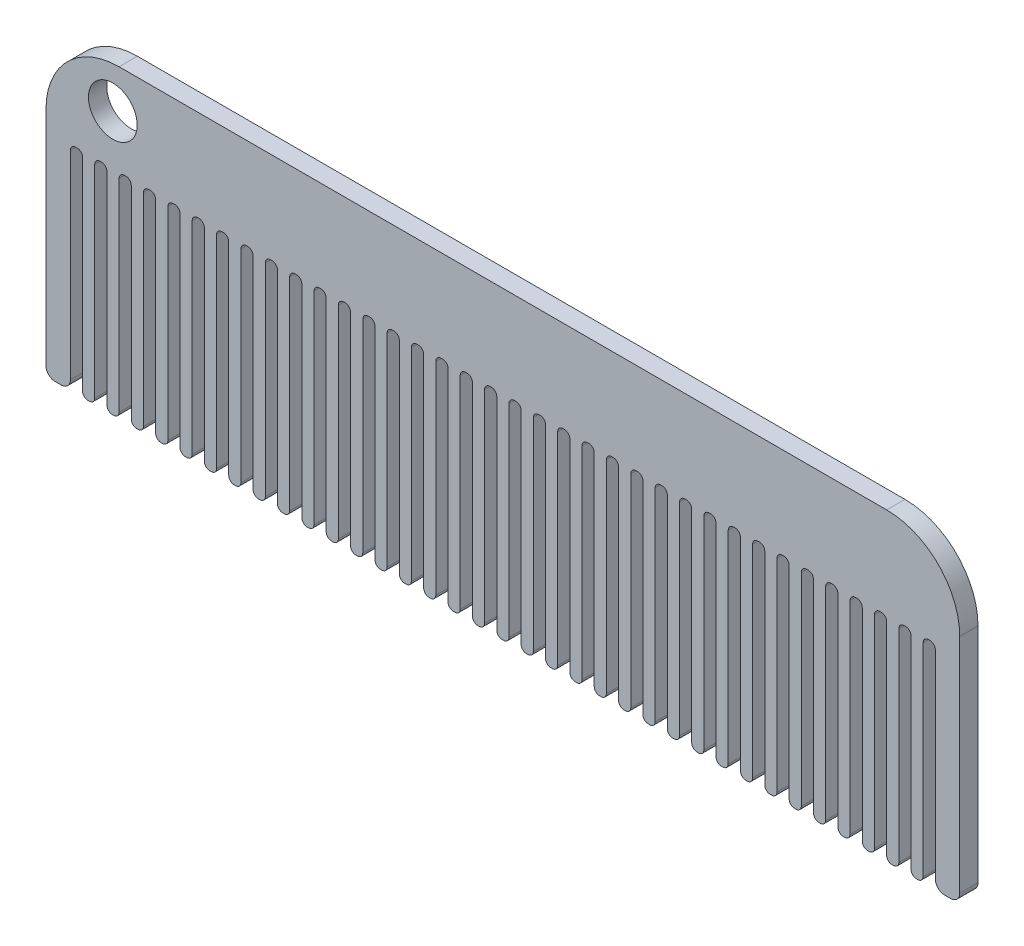
from build123d import *

# Parameters (mm, degrees)
BOSS_EXTRU_1_DEPTH      = 3
ESQUISSE2_R             = 4
ENL_V_MAT_EXTRU_1_DEPTH = 10


with BuildPart() as part:
    # Esquisse1 → Boss.-Extru.1 (new body)
    with BuildSketch(Plane.XY):
        with BuildLine():
            Line((0, 1.5), (0, 38))
            ThreePointArc((0, 38), (3.514718626, 46.485281374), (12, 50))
            Line((12, 50), (138, 50))
            ThreePointArc((138, 50), (146.485281374, 46.485281374), (150, 38))
            Line((150, 38), (150, 1.5))
            ThreePointArc((150, 1.5), (149.560660172, 0.439339828), (148.5, 0))
            Line((148.5, 0), (147.5, 0))
            ThreePointArc((147.5, 0), (146.439339828, 0.439339828), (146, 1.5))
            Line((146, 1.5), (146, 34.12))
            ThreePointArc((146, 34.12), (145.742253967, 34.742253967), (145.12, 35))
            Line((145.12, 35), (144.88, 35))
            ThreePointArc((144.88, 35), (144.257746033, 34.742253967), (144, 34.12))
            Line((144, 34.12), (144, 0.88))
            ThreePointArc((144, 0.88), (143.742253967, 0.257746033), (143.12, 0))
            Line((143.12, 0), (142.88, 0))
            ThreePointArc((142.88, 0), (142.257746033, 0.257746033), (142, 0.88))
            Line((142, 0.88), (142, 34.12))
            ThreePointArc((142, 34.12), (141.742253967, 34.742253967), (141.12, 35))
            Line((141.12, 35), (140.88, 35))
            ThreePointArc((140.88, 35), (140.257746033, 34.742253967), (140, 34.12))
            Line((140, 34.12), (140, 0.88))
            ThreePointArc((140, 0.88), (139.742253967, 0.257746033), (139.12, 0))
            Line((139.12, 0), (138.88, 0))
            ThreePointArc((138.88, 0), (138.257746033, 0.257746033), (138, 0.88))
            Line((138, 0.88), (138, 34.12))
            ThreePointArc((138, 34.12), (137.742253967, 34.742253967), (137.12, 35))
            Line((137.12, 35), (136.88, 35))
            ThreePointArc((136.88, 35), (136.257746033, 34.742253967), (136, 34.12))
            Line((136, 34.12), (136, 0.88))
            ThreePointArc((136, 0.88), (135.742253967, 0.257746033), (135.12, 0))
            Line((135.12, 0), (134.88, 0))
            ThreePointArc((134.88, 0), (134.257746033, 0.257746033), (134, 0.88))
            Line((134, 0.88), (134, 34.12))
            ThreePointArc((134, 34.12), (133.742253967, 34.742253967), (133.12, 35))
            Line((133.12, 35), (132.88, 35))
            ThreePointArc((132.88, 35), (132.257746033, 34.742253967), (132, 34.12))
            Line((132, 34.12), (132, 0.88))
            ThreePointArc((132, 0.88), (131.742253967, 0.257746033), (131.12, 0))
            Line((131.12, 0), (130.88, 0))
            ThreePointArc((130.88, 0), (130.257746033, 0.257746033), (130, 0.88))
            Line((130, 0.88), (130, 34.12))
            ThreePointArc((130, 34.12), (129.742253967, 34.742253967), (129.12, 35))
            Line((129.12, 35), (128.88, 35))
            ThreePointArc((128.88, 35), (128.257746033, 34.742253967), (128, 34.12))
            Line((128, 34.12), (128, 0.88))
            ThreePointArc((128, 0.88), (127.742253967, 0.257746033), (127.12, 0))
            Line((127.12, 0), (126.88, 0))
            ThreePointArc((126.88, 0), (126.257746033, 0.257746033), (126, 0.88))
            Line((126, 0.88), (126, 34.12))
            ThreePointArc((126, 34.12), (125.742253967, 34.742253967), (125.12, 35))
            Line((125.12, 35), (124.88, 35))
            ThreePointArc((124.88, 35), (124.257746033, 34.742253967), (124, 34.12))
            Line((124, 34.12), (124, 0.88))
            ThreePointArc((124, 0.88), (123.742253967, 0.257746033), (123.12, 0))
            Line((123.12, 0), (122.88, 0))
            ThreePointArc((122.88, 0), (122.257746033, 0.257746033), (122, 0.88))
            Line((122, 0.88), (122, 34.12))
            ThreePointArc((122, 34.12), (121.742253967, 34.742253967), (121.12, 35))
            Line((121.12, 35), (120.88, 35))
            ThreePointArc((120.88, 35), (120.257746033, 34.742253967), (120, 34.12))
            Line((120, 34.12), (120, 0.88))
            ThreePointArc((120, 0.88), (119.742253967, 0.257746033), (119.12, 0))
            Line((119.12, 0), (118.88, 0))
            ThreePointArc((118.88, 0), (118.257746033, 0.257746033), (118, 0.88))
            Line((118, 0.88), (118, 34.12))
            ThreePointArc((118, 34.12), (117.742253967, 34.742253967), (117.12, 35))
            Line((117.12, 35), (116.88, 35))
            ThreePointArc((116.88, 35), (116.257746033, 34.742253967), (116, 34.12))
            Line((116, 34.12), (116, 0.88))
            ThreePointArc((116, 0.88), (115.742253967, 0.257746033), (115.12, 0))
            Line((115.12, 0), (114.88, 0))
            ThreePointArc((114.88, 0), (114.257746033, 0.257746033), (114, 0.88))
            Line((114, 0.88), (114, 34.12))
            ThreePointArc((114, 34.12), (113.742253967, 34.742253967), (113.12, 35))
            Line((113.12, 35), (112.88, 35))
            ThreePointArc((112.88, 35), (112.257746033, 34.742253967), (112, 34.12))
            Line((112, 34.12), (112, 0.88))
            ThreePointArc((112, 0.88), (111.742253967, 0.257746033), (111.12, 0))
            Line((111.12, 0), (110.88, 0))
            ThreePointArc((110.88, 0), (110.257746033, 0.257746033), (110, 0.88))
            Line((110, 0.88), (110, 34.12))
            ThreePointArc((110, 34.12), (109.742253967, 34.742253967), (109.12, 35))
            Line((109.12, 35), (108.88, 35))
            ThreePointArc((108.88, 35), (108.257746033, 34.742253967), (108, 34.12))
            Line((108, 34.12), (108, 0.88))
            ThreePointArc((108, 0.88), (107.742253967, 0.257746033), (107.12, 0))
            Line((107.12, 0), (106.88, 0))
            ThreePointArc((106.88, 0), (106.257746033, 0.257746033), (106, 0.88))
            Line((106, 0.88), (106, 34.12))
            ThreePointArc((106, 34.12), (105.742253967, 34.742253967), (105.12, 35))
            Line((105.12, 35), (104.88, 35))
            ThreePointArc((104.88, 35), (104.257746033, 34.742253967), (104, 34.12))
            Line((104, 34.12), (104, 0.88))
            ThreePointArc((104, 0.88), (103.742253967, 0.257746033), (103.12, 0))
            Line((103.12, 0), (102.88, 0))
            ThreePointArc((102.88, 0), (102.257746033, 0.257746033), (102, 0.88))
            Line((102, 0.88), (102, 34.12))
            ThreePointArc((102, 34.12), (101.742253967, 34.742253967), (101.12, 35))
            Line((101.12, 35), (100.88, 35))
            ThreePointArc((100.88, 35), (100.257746033, 34.742253967), (100, 34.12))
            Line((100, 34.12), (100, 0.88))
            ThreePointArc((100, 0.88), (99.742253967, 0.257746033), (99.12, 0))
            Line((99.12, 0), (98.88, 0))
            ThreePointArc((98.88, 0), (98.257746033, 0.257746033), (98, 0.88))
            Line((98, 0.88), (98, 34.12))
            ThreePointArc((98, 34.12), (97.742253967, 34.742253967), (97.12, 35))
            Line((97.12, 35), (96.88, 35))
            ThreePointArc((96.88, 35), (96.257746033, 34.742253967), (96, 34.12))
            Line((96, 34.12), (96, 0.88))
            ThreePointArc((96, 0.88), (95.742253967, 0.257746033), (95.12, 0))
            Line((95.12, 0), (94.88, 0))
            ThreePointArc((94.88, 0), (94.257746033, 0.257746033), (94, 0.88))
            Line((94, 0.88), (94, 34.12))
            ThreePointArc((94, 34.12), (93.742253967, 34.742253967), (93.12, 35))
            Line((93.12, 35), (92.88, 35))
            ThreePointArc((92.88, 35), (92.257746033, 34.742253967), (92, 34.12))
            Line((92, 34.12), (92, 0.88))
            ThreePointArc((92, 0.88), (91.742253967, 0.257746033), (91.12, 0))
            Line((91.12, 0), (90.88, 0))
            ThreePointArc((90.88, 0), (90.257746033, 0.257746033), (90, 0.88))
            Line((90, 0.88), (90, 34.12))
            ThreePointArc((90, 34.12), (89.742253967, 34.742253967), (89.12, 35))
            Line((89.12, 35), (88.88, 35))
            ThreePointArc((88.88, 35), (88.257746033, 34.742253967), (88, 34.12))
            Line((88, 34.12), (88, 0.88))
            ThreePointArc((88, 0.88), (87.742253967, 0.257746033), (87.12, 0))
            Line((87.12, 0), (86.88, 0))
            ThreePointArc((86.88, 0), (86.257746033, 0.257746033), (86, 0.88))
            Line((86, 0.88), (86, 34.12))
            ThreePointArc((86, 34.12), (85.742253967, 34.742253967), (85.12, 35))
            Line((85.12, 35), (84.88, 35))
            ThreePointArc((84.88, 35), (84.257746033, 34.742253967), (84, 34.12))
            Line((84, 34.12), (84, 0.88))
            ThreePointArc((84, 0.88), (83.742253967, 0.257746033), (83.12, 0))
            Line((83.12, 0), (82.88, 0))
            ThreePointArc((82.88, 0), (82.257746033, 0.257746033), (82, 0.88))
            Line((82, 0.88), (82, 34.12))
            ThreePointArc((82, 34.12), (81.742253967, 34.742253967), (81.12, 35))
            Line((81.12, 35), (80.88, 35))
            ThreePointArc((80.88, 35), (80.257746033, 34.742253967), (80, 34.12))
            Line((80, 34.12), (80, 0.88))
            ThreePointArc((80, 0.88), (79.742253967, 0.257746033), (79.12, 0))
            Line((79.12, 0), (78.88, 0))
            ThreePointArc((78.88, 0), (78.257746033, 0.257746033), (78, 0.88))
            Line((78, 0.88), (78, 34.12))
            ThreePointArc((78, 34.12), (77.742253967, 34.742253967), (77.12, 35))
            Line((77.12, 35), (76.88, 35))
            ThreePointArc((76.88, 35), (76.257746033, 34.742253967), (76, 34.12))
            Line((76, 34.12), (76, 0.88))
            ThreePointArc((76, 0.88), (75.742253967, 0.257746033), (75.12, 0))
            Line((75.12, 0), (74.88, 0))
            ThreePointArc((74.88, 0), (74.257746033, 0.257746033), (74, 0.88))
            Line((74, 0.88), (74, 34.12))
            ThreePointArc((74, 34.12), (73.742253967, 34.742253967), (73.12, 35))
            Line((73.12, 35), (72.88, 35))
            ThreePointArc((72.88, 35), (72.257746033, 34.742253967), (72, 34.12))
            Line((72, 34.12), (72, 0.88))
            ThreePointArc((72, 0.88), (71.742253967, 0.257746033), (71.12, 0))
            Line((71.12, 0), (70.88, 0))
            ThreePointArc((70.88, 0), (70.257746033, 0.257746033), (70, 0.88))
            Line((70, 0.88), (70, 34.12))
            ThreePointArc((70, 34.12), (69.742253967, 34.742253967), (69.12, 35))
            Line((69.12, 35), (68.88, 35))
            ThreePointArc((68.88, 35), (68.257746033, 34.742253967), (68, 34.12))
            Line((68, 34.12), (68, 0.88))
            ThreePointArc((68, 0.88), (67.742253967, 0.257746033), (67.12, 0))
            Line((67.12, 0), (66.88, 0))
            ThreePointArc((66.88, 0), (66.257746033, 0.257746033), (66, 0.88))
            Line((66, 0.88), (66, 34.12))
            ThreePointArc((66, 34.12), (65.742253967, 34.742253967), (65.12, 35))
            Line((65.12, 35), (64.88, 35))
            ThreePointArc((64.88, 35), (64.257746033, 34.742253967), (64, 34.12))
            Line((64, 34.12), (64, 0.88))
            ThreePointArc((64, 0.88), (63.742253967, 0.257746033), (63.12, 0))
            Line((63.12, 0), (62.88, 0))
            ThreePointArc((62.88, 0), (62.257746033, 0.257746033), (62, 0.88))
            Line((62, 0.88), (62, 34.12))
            ThreePointArc((62, 34.12), (61.742253967, 34.742253967), (61.12, 35))
            Line((61.12, 35), (60.88, 35))
            ThreePointArc((60.88, 35), (60.257746033, 34.742253967), (60, 34.12))
            Line((60, 34.12), (60, 0.88))
            ThreePointArc((60, 0.88), (59.742253967, 0.257746033), (59.12, 0))
            Line((59.12, 0), (58.88, 0))
            ThreePointArc((58.88, 0), (58.257746033, 0.257746033), (58, 0.88))
            Line((58, 0.88), (58, 34.12))
            ThreePointArc((58, 34.12), (57.742253967, 34.742253967), (57.12, 35))
            Line((57.12, 35), (56.88, 35))
            ThreePointArc((56.88, 35), (56.257746033, 34.742253967), (56, 34.12))
            Line((56, 34.12), (56, 0.88))
            ThreePointArc((56, 0.88), (55.742253967, 0.257746033), (55.12, 0))
            Line((55.12, 0), (54.88, 0))
            ThreePointArc((54.88, 0), (54.257746033, 0.257746033), (54, 0.88))
            Line((54, 0.88), (54, 34.12))
            ThreePointArc((54, 34.12), (53.742253967, 34.742253967), (53.12, 35))
            Line((53.12, 35), (52.88, 35))
            ThreePointArc((52.88, 35), (52.257746033, 34.742253967), (52, 34.12))
            Line((52, 34.12), (52, 0.88))
            ThreePointArc((52, 0.88), (51.742253967, 0.257746033), (51.12, 0))
            Line((51.12, 0), (50.88, 0))
            ThreePointArc((50.88, 0), (50.257746033, 0.257746033), (50, 0.88))
            Line((50, 0.88), (50, 34.12))
            ThreePointArc((50, 34.12), (49.742253967, 34.742253967), (49.12, 35))
            Line((49.12, 35), (48.88, 35))
            ThreePointArc((48.88, 35), (48.257746033, 34.742253967), (48, 34.12))
            Line((48, 34.12), (48, 0.88))
            ThreePointArc((48, 0.88), (47.742253967, 0.257746033), (47.12, 0))
            Line((47.12, 0), (46.88, 0))
            ThreePointArc((46.88, 0), (46.257746033, 0.257746033), (46, 0.88))
            Line((46, 0.88), (46, 34.12))
            ThreePointArc((46, 34.12), (45.742253967, 34.742253967), (45.12, 35))
            Line((45.12, 35), (44.88, 35))
            ThreePointArc((44.88, 35), (44.257746033, 34.742253967), (44, 34.12))
            Line((44, 34.12), (44, 0.88))
            ThreePointArc((44, 0.88), (43.742253967, 0.257746033), (43.12, 0))
            Line((43.12, 0), (42.88, 0))
            ThreePointArc((42.88, 0), (42.257746033, 0.257746033), (42, 0.88))
            Line((42, 0.88), (42, 34.12))
            ThreePointArc((42, 34.12), (41.742253967, 34.742253967), (41.12, 35))
            Line((41.12, 35), (40.88, 35))
            ThreePointArc((40.88, 35), (40.257746033, 34.742253967), (40, 34.12))
            Line((40, 34.12), (40, 0.88))
            ThreePointArc((40, 0.88), (39.742253967, 0.257746033), (39.12, 0))
            Line((39.12, 0), (38.88, 0))
            ThreePointArc((38.88, 0), (38.257746033, 0.257746033), (38, 0.88))
            Line((38, 0.88), (38, 34.12))
            ThreePointArc((38, 34.12), (37.742253967, 34.742253967), (37.12, 35))
            Line((37.12, 35), (36.88, 35))
            ThreePointArc((36.88, 35), (36.257746033, 34.742253967), (36, 34.12))
            Line((36, 34.12), (36, 0.88))
            ThreePointArc((36, 0.88), (35.742253967, 0.257746033), (35.12, 0))
            Line((35.12, 0), (34.88, 0))
            ThreePointArc((34.88, 0), (34.257746033, 0.257746033), (34, 0.88))
            Line((34, 0.88), (34, 34.12))
            ThreePointArc((34, 34.12), (33.742253967, 34.742253967), (33.12, 35))
            Line((33.12, 35), (32.88, 35))
            ThreePointArc((32.88, 35), (32.257746033, 34.742253967), (32, 34.12))
            Line((32, 34.12), (32, 0.88))
            ThreePointArc((32, 0.88), (31.742253967, 0.257746033), (31.12, 0))
            Line((31.12, 0), (30.88, 0))
            ThreePointArc((30.88, 0), (30.257746033, 0.257746033), (30, 0.88))
            Line((30, 0.88), (30, 34.12))
            ThreePointArc((30, 34.12), (29.742253967, 34.742253967), (29.12, 35))
            Line((29.12, 35), (28.88, 35))
            ThreePointArc((28.88, 35), (28.257746033, 34.742253967), (28, 34.12))
            Line((28, 34.12), (28, 0.88))
            ThreePointArc((28, 0.88), (27.742253967, 0.257746033), (27.12, 0))
            Line((27.12, 0), (26.88, 0))
            ThreePointArc((26.88, 0), (26.257746033, 0.257746033), (26, 0.88))
            Line((26, 0.88), (26, 34.12))
            ThreePointArc((26, 34.12), (25.742253967, 34.742253967), (25.12, 35))
            Line((25.12, 35), (24.88, 35))
            ThreePointArc((24.88, 35), (24.257746033, 34.742253967), (24, 34.12))
            Line((24, 34.12), (24, 0.88))
            ThreePointArc((24, 0.88), (23.742253967, 0.257746033), (23.12, 0))
            Line((23.12, 0), (22.88, 0))
            ThreePointArc((22.88, 0), (22.257746033, 0.257746033), (22, 0.88))
            Line((22, 0.88), (22, 34.12))
            ThreePointArc((22, 34.12), (21.742253967, 34.742253967), (21.12, 35))
            Line((21.12, 35), (20.88, 35))
            ThreePointArc((20.88, 35), (20.257746033, 34.742253967), (20, 34.12))
            Line((20, 34.12), (20, 0.88))
            ThreePointArc((20, 0.88), (19.742253967, 0.257746033), (19.12, 0))
            Line((19.12, 0), (18.88, 0))
            ThreePointArc((18.88, 0), (18.257746033, 0.257746033), (18, 0.88))
            Line((18, 0.88), (18, 34.12))
            ThreePointArc((18, 34.12), (17.742253967, 34.742253967), (17.12, 35))
            Line((17.12, 35), (16.88, 35))
            ThreePointArc((16.88, 35), (16.257746033, 34.742253967), (16, 34.12))
            Line((16, 34.12), (16, 0.88))
            ThreePointArc((16, 0.88), (15.742253967, 0.257746033), (15.12, 0))
            Line((15.12, 0), (14.88, 0))
            ThreePointArc((14.88, 0), (14.257746033, 0.257746033), (14, 0.88))
            Line((14, 0.88), (14, 34.12))
            ThreePointArc((14, 34.12), (13.742253967, 34.742253967), (13.12, 35))
            Line((13.12, 35), (12.88, 35))
            ThreePointArc((12.88, 35), (12.257746033, 34.742253967), (12, 34.12))
            Line((12, 34.12), (12, 0.88))
            ThreePointArc((12, 0.88), (11.742253967, 0.257746033), (11.12, 0))
            Line((11.12, 0), (10.88, 0))
            ThreePointArc((10.88, 0), (10.257746033, 0.257746033), (10, 0.88))
            Line((10, 0.88), (10, 34.12))
            ThreePointArc((10, 34.12), (9.742253967, 34.742253967), (9.12, 35))
            Line((9.12, 35), (8.88, 35))
            ThreePointArc((8.88, 35), (8.257746033, 34.742253967), (8, 34.12))
            Line((8, 34.12), (8, 0.88))
            ThreePointArc((8, 0.88), (7.742253967, 0.257746033), (7.12, 0))
            Line((7.12, 0), (6.88, 0))
            ThreePointArc((6.88, 0), (6.257746033, 0.257746033), (6, 0.88))
            Line((6, 0.88), (6, 34.12))
            ThreePointArc((6, 34.12), (5.742253967, 34.742253967), (5.12, 35))
            Line((5.12, 35), (4.88, 35))
            ThreePointArc((4.88, 35), (4.257746033, 34.742253967), (4, 34.12))
            Line((4, 34.12), (4, 1.5))
            ThreePointArc((4, 1.5), (3.560660172, 0.439339828), (2.5, 0))
            Line((2.5, 0), (1.5, 0))
            ThreePointArc((1.5, 0), (0.439339828, 0.439339828), (0, 1.5))
        make_face()
    extrude(amount=BOSS_EXTRU_1_DEPTH)

    # Esquisse2 → Enlèv. mat.-Extru.1 (cut)
    with BuildSketch(Plane.XY.offset(3)):
        with Locations((10.969243539, 43.174891482)):
            Circle(ESQUISSE2_R)
    extrude(amount=-ENL_V_MAT_EXTRU_1_DEPTH, mode=Mode.SUBTRACT)


solid = part.part
